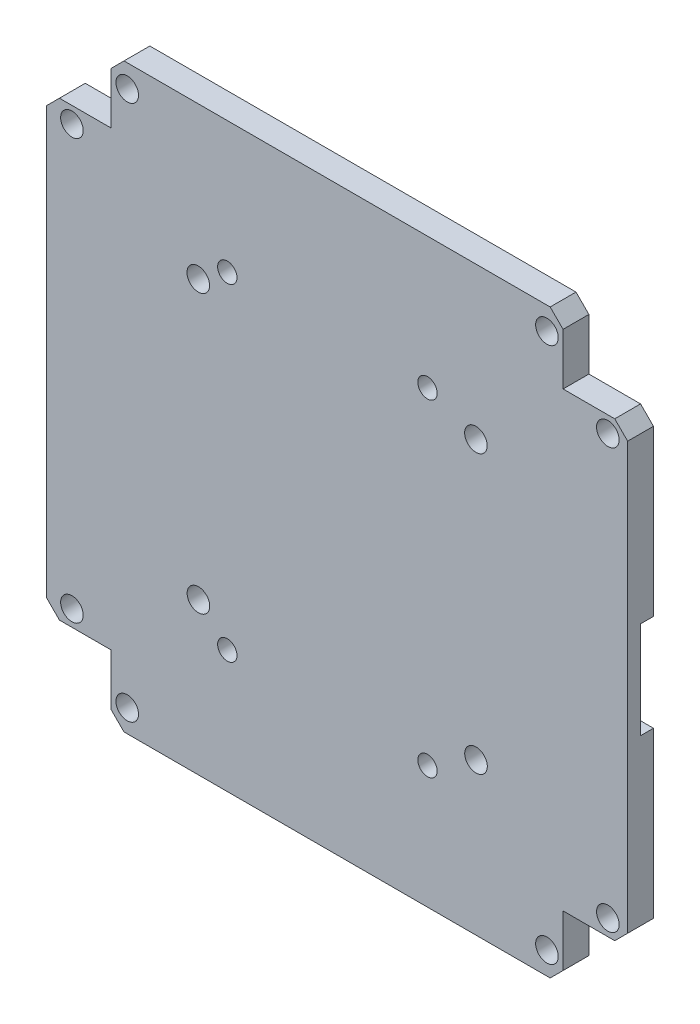
from build123d import *

# Parameters (mm, degrees)
SKETCH1_W           = 90
SKETCH1_H           = 70
BOSS_EXTRUDE1_DEPTH = 4
SKETCH2_R           = 1.75
CUT_EXTRUDE1_DEPTH  = 5
CHAMFER1_SIZE       = 2
CHAMFER2_SIZE       = 2
CHAMFER3_SIZE       = 2
CHAMFER4_SIZE       = 2
SKETCH5_W           = 70
SKETCH5_H           = 4
BOSS_EXTRUDE3_DEPTH = 10
SKETCH4_W           = 70
SKETCH4_H           = 4
BOSS_EXTRUDE4_DEPTH = 10
SKETCH6_R           = 1.75
CUT_EXTRUDE2_DEPTH  = 10
CHAMFER5_SIZE       = 2
SKETCH7_W           = 40
SKETCH7_H           = 40
CUT_EXTRUDE3_DEPTH  = 2
SKETCH8_W           = 25
SKETCH8_H           = 15
CUT_EXTRUDE4_DEPTH  = 2
SKETCH9_R           = 1.5
CUT_EXTRUDE5_DEPTH  = 4


with BuildPart() as part:
    # Sketch1 → Boss-Extrude1 (new body)
    with BuildSketch(Plane.XY):
        with Locations((44.768273235, 35.193370166)):
            Rectangle(SKETCH1_W, SKETCH1_H)
    extrude(amount=BOSS_EXTRUDE1_DEPTH)

    # Sketch2 → Cut-Extrude1 (cut)
    with BuildSketch(Plane.XY.offset(4)):
        with Locations((3.703568783, 2.693370166)):
            Circle(SKETCH2_R)
        with Locations((86.703568783, 2.694436567)):
            Circle(SKETCH2_R)
        with Locations((86.703273235, 67.693370166)):
            Circle(SKETCH2_R)
        with Locations((3.703273235, 67.693370166)):
            Circle(SKETCH2_R)
        with Locations((23.297725672, 13.693370166)):
            Circle(SKETCH2_R)
        with Locations((66.284051901, 13.693370166)):
            Circle(SKETCH2_R)
        with Locations((66.268273235, 56.693370166)):
            Circle(SKETCH2_R)
        with Locations((23.268273235, 56.693370166)):
            Circle(SKETCH2_R)
    extrude(amount=-CUT_EXTRUDE1_DEPTH, mode=Mode.SUBTRACT)

    # Chamfer1
    chamfer1_edges = [part.edges().sort_by_distance(p)[0] for p in [
        (89.768273235, 0.193370166, 2),
    ]]
    chamfer(chamfer1_edges, length=CHAMFER1_SIZE)

    # Chamfer2
    chamfer2_edges = [part.edges().sort_by_distance(p)[0] for p in [
        (-0.231726765, 0.193370166, 2),
    ]]
    chamfer(chamfer2_edges, length=CHAMFER2_SIZE)

    # Chamfer3
    chamfer3_edges = [part.edges().sort_by_distance(p)[0] for p in [
        (-0.231726765, 70.193370166, 2),
    ]]
    chamfer(chamfer3_edges, length=CHAMFER3_SIZE)

    # Chamfer4
    chamfer4_edges = [part.edges().sort_by_distance(p)[0] for p in [
        (89.768273235, 70.193370166, 2),
    ]]
    chamfer(chamfer4_edges, length=CHAMFER4_SIZE)

    # Sketch5 → Boss-Extrude3 (add)
    with BuildSketch(Plane(origin=(0, 70.193370166, 0), x_dir=(1, 0, 0), z_dir=(0, 1, 0))):
        with Locations((44.768273235, -2)):
            Rectangle(SKETCH5_W, SKETCH5_H)
    extrude(amount=BOSS_EXTRUDE3_DEPTH)

    # Sketch4 → Boss-Extrude4 (add)
    with BuildSketch(Plane(origin=(0, 0.193370166, 0), x_dir=(-1, 0, 0), z_dir=(0, -1, 0))):
        with Locations((-44.768273235, -2)):
            Rectangle(SKETCH4_W, SKETCH4_H)
    extrude(amount=BOSS_EXTRUDE4_DEPTH)

    # Sketch6 → Cut-Extrude2 (cut)
    with BuildSketch(Plane(origin=(0, 0, 0), x_dir=(-1, 0, 0), z_dir=(0, 0, -1))):
        with Locations((-12.268273235, 76.693370166)):
            Circle(SKETCH6_R)
        with Locations((-77.268273235, 76.693370166)):
            Circle(SKETCH6_R)
        with Locations((-77.268273235, -6.306629834)):
            Circle(SKETCH6_R)
        with Locations((-12.268273235, -6.306629834)):
            Circle(SKETCH6_R)
    extrude(amount=-CUT_EXTRUDE2_DEPTH, mode=Mode.SUBTRACT)

    # Chamfer5
    chamfer5_edges = [part.edges().sort_by_distance(p)[0] for p in [
        (9.768273235, 80.193370166, 2),
        (79.768273235, 80.193370166, 2),
        (9.768273235, -9.806629834, 2),
        (79.768273235, -9.806629834, 2),
    ]]
    chamfer(chamfer5_edges, length=CHAMFER5_SIZE)

    # Sketch7 → Cut-Extrude3 (cut)
    with BuildSketch(Plane(origin=(0, 0, 0), x_dir=(-1, 0, 0), z_dir=(0, 0, -1))):
        with Locations((-44.768273235, 35.193370166)):
            Rectangle(SKETCH7_W, SKETCH7_H)
    extrude(amount=-CUT_EXTRUDE3_DEPTH, mode=Mode.SUBTRACT)

    # Sketch8 → Cut-Extrude4 (cut)
    with BuildSketch(Plane(origin=(0, 0, 0), x_dir=(-1, 0, 0), z_dir=(0, 0, -1))):
        with Locations((-77.268273235, 35.193370166)):
            Rectangle(SKETCH8_W, SKETCH8_H)
    extrude(amount=-CUT_EXTRUDE4_DEPTH, mode=Mode.SUBTRACT)

    # Sketch9 → Cut-Extrude5 (cut)
    with BuildSketch(Plane(origin=(0, 0, 0), x_dir=(-1, 0, 0), z_dir=(0, 0, -1))):
        with Locations((-27.768273235, 9.193370166)):
            Circle(SKETCH9_R)
        with Locations((-58.768273235, 9.193370166)):
            Circle(SKETCH9_R)
        with Locations((-27.768273235, 59.856282799)):
            Circle(SKETCH9_R)
        with Locations((-58.768273235, 59.856282799)):
            Circle(SKETCH9_R)
    extrude(amount=-CUT_EXTRUDE5_DEPTH, mode=Mode.SUBTRACT)


solid = part.part
